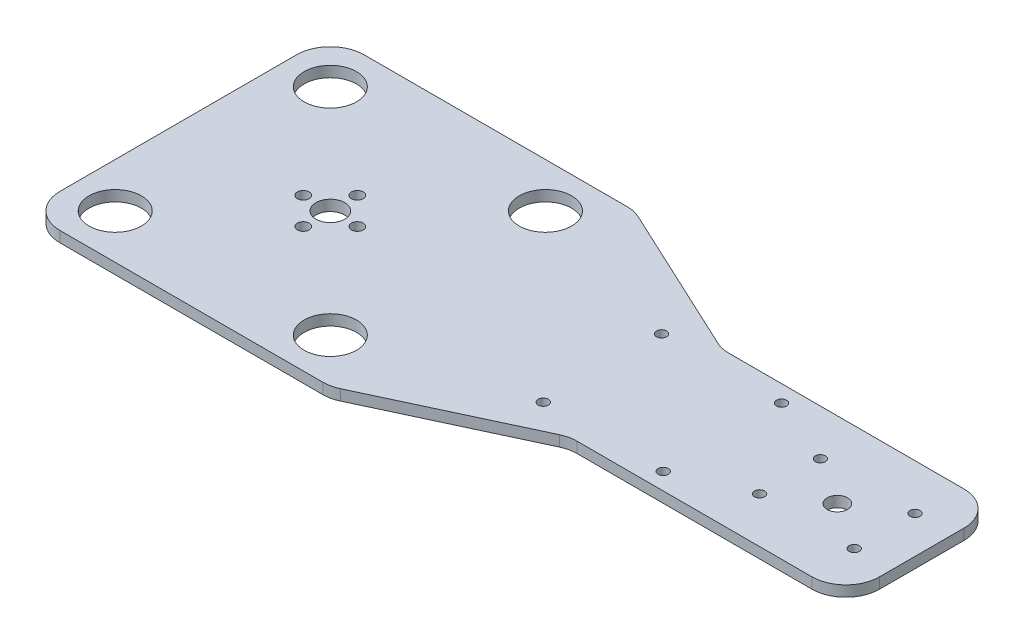
from build123d import *

# Parameters (mm, degrees)
BOSS_EXTRUDE1_DEPTH = 3.175
SKETCH4_R           = 3
SKETCH4_R_2         = 1.5
CUT_EXTRUDE1_DEPTH  = 181.721002169
SKETCH5_R           = 4.25
CUT_EXTRUDE2_DEPTH  = 181.721002169
SKETCH10_R          = 1.5
CUT_EXTRUDE4_DEPTH  = 181.721002169
FILLET1_R           = 10
FILLET2_R           = 10
SKETCH11_R          = 7.75
CUT_EXTRUDE5_DEPTH  = 181.721002169
SKETCH13_R          = 1.75
CUT_EXTRUDE6_DEPTH  = 181.721002169


with BuildPart() as part:
    # Sketch1 → Boss-Extrude1 (new body)
    with BuildSketch(Plane(origin=(0, 0, 0), x_dir=(1, 0, 0), z_dir=(0, 1, 0))):
        Polygon((45, -45), (93.251405711, -22.5), (175, -22.5), (175, 22.5), (93.251405711, 22.5), (45, 45), (-45, 45), (-45, -45), align=None)
    extrude(amount=BOSS_EXTRUDE1_DEPTH)

    # Sketch4 → Cut-Extrude1 (cut, through all)
    with BuildSketch(Plane(origin=(0, 3.175, 0), x_dir=(1, 0, 0), z_dir=(0, 1, 0))):
        with Locations(Location((150, 0, 0), (0, 0, 270))):
            Circle(SKETCH4_R)
        with Locations(Location((136, 9, 0), (0, 0, 270))):
            Circle(SKETCH4_R_2)
        with Locations(Location((164, 9, 0), (0, 0, 90))):
            Circle(SKETCH4_R_2)
        with Locations(Location((164, -9, 0), (0, 0, 270))):
            Circle(SKETCH4_R_2)
        with Locations(Location((136, -9, 0), (0, 0, 90))):
            Circle(SKETCH4_R_2)
    extrude(amount=-CUT_EXTRUDE1_DEPTH, mode=Mode.SUBTRACT)

    # Sketch5 → Cut-Extrude2 (cut, through all)
    with BuildSketch(Plane(origin=(0, 3.175, 0), x_dir=(1, 0, 0), z_dir=(0, 1, 0))):
        with Locations(Location((0, 0, 0), (0, 0, 270))):
            Circle(SKETCH5_R)
    extrude(amount=-CUT_EXTRUDE2_DEPTH, mode=Mode.SUBTRACT)

    # Sketch10 → Cut-Extrude4 (cut, through all)
    with BuildSketch(Plane(origin=(0, 3.175, 0), x_dir=(1, 0, 0), z_dir=(0, 1, 0))):
        with Locations(Location((80.5, -17.5, 0), (0, 0, 270))):
            Circle(SKETCH10_R)
        with Locations(Location((116, -17.5, 0), (0, 0, 270))):
            Circle(SKETCH10_R)
        with Locations(Location((116, 17.5, 0), (0, 0, 90))):
            Circle(SKETCH10_R)
        with Locations(Location((80.5, 17.5, 0), (0, 0, 90))):
            Circle(SKETCH10_R)
    extrude(amount=-CUT_EXTRUDE4_DEPTH, mode=Mode.SUBTRACT)

    # Fillet1
    fillet1_edges = [part.edges().sort_by_distance(p)[0] for p in [
        (-45, 1.5875, 45),
        (-45, 1.5875, -45),
        (175, 1.5875, -22.5),
        (175, 1.5875, 22.5),
    ]]
    fillet(fillet1_edges, radius=FILLET1_R)

    # Fillet2
    fillet2_edges = [part.edges().sort_by_distance(p)[0] for p in [
        (93.251405711, 1.5875, 22.5),
        (45, 1.5875, 45),
        (45, 1.5875, -45),
        (93.251405711, 1.5875, -22.5),
    ]]
    fillet(fillet2_edges, radius=FILLET2_R)

    # Sketch11 → Cut-Extrude5 (cut, through all)
    with BuildSketch(Plane(origin=(0, 3.175, 0), x_dir=(1, 0, 0), z_dir=(0, 1, 0))):
        with Locations(Location((-31.819805153, 31.819805153, 0), (0, 0, 270))):
            Circle(SKETCH11_R)
        with Locations(Location((31.819805153, 31.819805153, 0), (0, 0, 270))):
            Circle(SKETCH11_R)
        with Locations(Location((31.819805153, -31.819805153, 0), (0, 0, 270))):
            Circle(SKETCH11_R)
        with Locations(Location((-31.819805153, -31.819805153, 0), (0, 0, 270))):
            Circle(SKETCH11_R)
    extrude(amount=-CUT_EXTRUDE5_DEPTH, mode=Mode.SUBTRACT)

    # Sketch13 → Cut-Extrude6 (cut, through all)
    with BuildSketch(Plane(origin=(0, 3.175, 0), x_dir=(1, 0, 0), z_dir=(0, 1, 0))):
        with Locations(Location((8, 0, 0), (0, 0, 270))):
            Circle(SKETCH13_R)
        with Locations(Location((0, -8, 0), (0, 0, 270))):
            Circle(SKETCH13_R)
        with Locations(Location((-8, 0, 0), (0, 0, 270))):
            Circle(SKETCH13_R)
        with Locations(Location((0, 8, 0), (0, 0, 270))):
            Circle(SKETCH13_R)
    extrude(amount=-CUT_EXTRUDE6_DEPTH, mode=Mode.SUBTRACT)


solid = part.part
